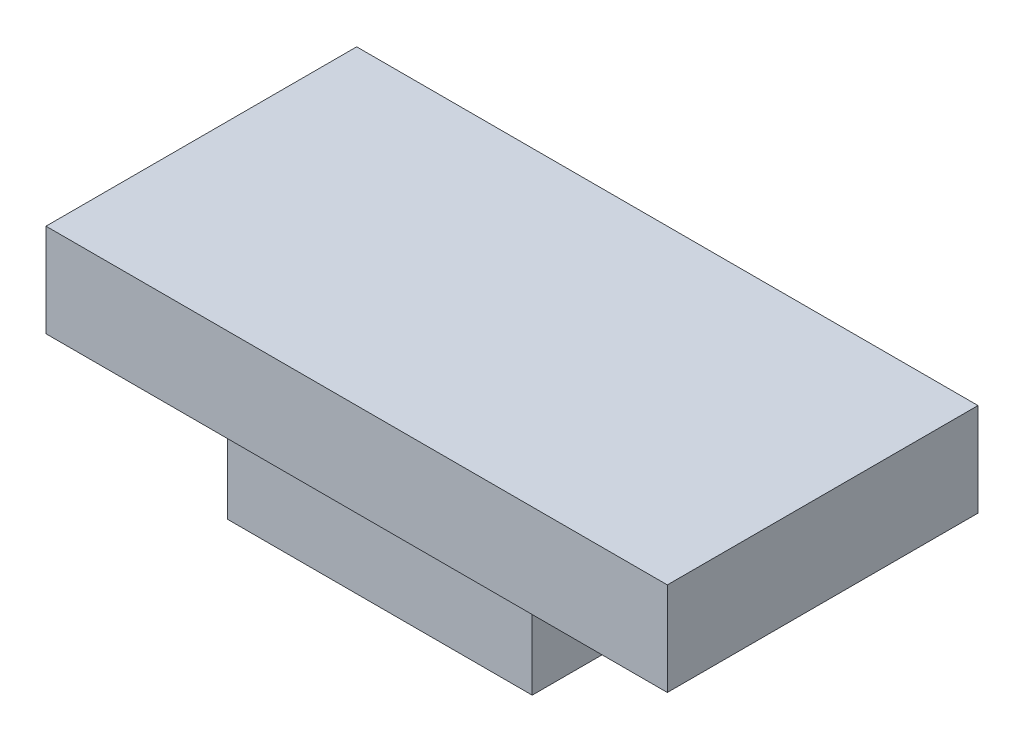
from build123d import *

# Parameters (mm, degrees)
SKETCH1_W           = 20
SKETCH1_H           = 10
BOSS_EXTRUDE1_DEPTH = 3
SKETCH2_W           = 9.8
SKETCH2_H           = 8.5
SKETCH2_W_2         = 5.8
SKETCH2_H_2         = 4.5
BOSS_EXTRUDE2_DEPTH = 3


with BuildPart() as part:
    # Sketch1 → Boss-Extrude1 (new body)
    with BuildSketch(Plane(origin=(0, 0, 0), x_dir=(1, 0, 0), z_dir=(0, 1, 0))):
        Rectangle(SKETCH1_W, SKETCH1_H)
    extrude(amount=BOSS_EXTRUDE1_DEPTH)

    # Sketch2 → Boss-Extrude2 (add)
    with BuildSketch(Plane.XZ):
        Rectangle(SKETCH2_W, SKETCH2_H)
        Rectangle(SKETCH2_W_2, SKETCH2_H_2, mode=Mode.SUBTRACT)
    extrude(amount=BOSS_EXTRUDE2_DEPTH)


solid = part.part
